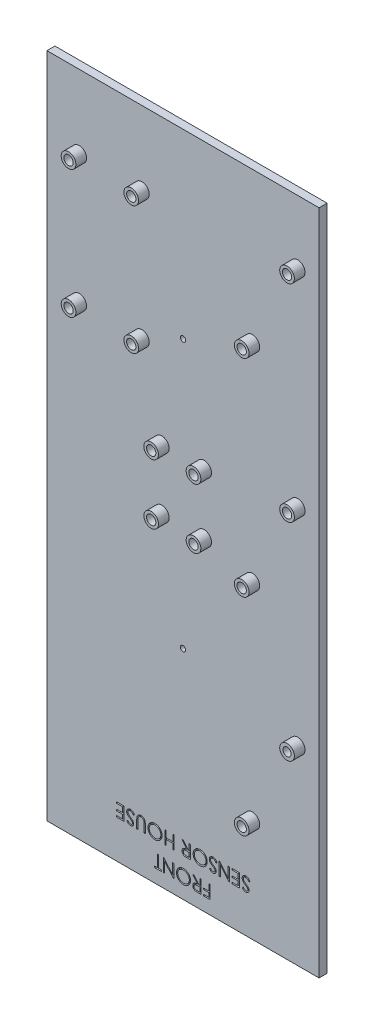
from build123d import *

# Parameters (mm, degrees)
BOSS_EXTRUDE1_DEPTH = 3
SKETCH2_R           = 1
CUT_EXTRUDE1_DEPTH  = 3
SKETCH5_R           = 2.75
BOSS_EXTRUDE2_DEPTH = 4
SKETCH6_R           = 1.75
SKETCH6_R_2         = 1.54123494
CUT_EXTRUDE2_DEPTH  = 4
CUT_EXTRUDE3_DEPTH  = 1


with BuildPart() as part:
    # Sketch1 → Boss-Extrude1 (new body)
    with BuildSketch(Plane(origin=(0, 0, 0), x_dir=(0, 1, 0), z_dir=(0, 0, 1))):
        Polygon((0, 110), (0, 8), (250, 8), (250, 85), (250, 110), (225, 110), (199.75, 110), (171.25, 110), align=None)
    extrude(amount=BOSS_EXTRUDE1_DEPTH)

    # Sketch2 → Cut-Extrude1 (cut)
    with BuildSketch(Plane.XY.offset(3)):
        with Locations((-59, 81.4)):
            Circle(SKETCH2_R)
        with Locations((-59, 181.94)):
            Circle(SKETCH2_R)
    extrude(amount=-CUT_EXTRUDE1_DEPTH, mode=Mode.SUBTRACT)

    # Sketch5 → Boss-Extrude2 (add)
    with BuildSketch(Plane.XY.offset(3)):
        with Locations((-66.934406815, 143.75)):
            Circle(SKETCH5_R)
        with Locations((-51.065593185, 143.75)):
            Circle(SKETCH5_R)
        with Locations((-66.934406815, 121.25)):
            Circle(SKETCH5_R)
        with Locations((-51.065593185, 121.25)):
            Circle(SKETCH5_R)
        with Locations((-16, 148.878093915)):
            Circle(SKETCH5_R)
        with Locations((-33, 116.121906085)):
            Circle(SKETCH5_R)
        with Locations((-16, 71.399280356)):
            Circle(SKETCH5_R)
        with Locations((-33, 38.643092525)):
            Circle(SKETCH5_R)
        with Locations((-16, 226.356907475)):
            Circle(SKETCH5_R)
        with Locations((-33, 193.600719644)):
            Circle(SKETCH5_R)
        with Locations((-97.892667427, 222.5)):
            Circle(SKETCH5_R)
        with Locations((-74.392667427, 222.5)):
            Circle(SKETCH5_R)
        with Locations((-74.392667427, 174.5)):
            Circle(SKETCH5_R)
        with Locations((-97.892667427, 174.5)):
            Circle(SKETCH5_R)
    extrude(amount=BOSS_EXTRUDE2_DEPTH)

    # Sketch6 → Cut-Extrude2 (cut)
    with BuildSketch(Plane.XY.offset(3)):
        with Locations((-66.934406815, 143.75)):
            Circle(SKETCH6_R)
        with Locations((-51.065593185, 143.75)):
            Circle(SKETCH6_R)
        with Locations((-66.934406815, 121.25)):
            Circle(SKETCH6_R)
        with Locations((-51.065593185, 121.25)):
            Circle(SKETCH6_R)
        with Locations((-33, 116.121906085)):
            Circle(SKETCH6_R)
        with Locations((-16, 148.878093915)):
            Circle(SKETCH6_R)
        with Locations((-16, 71.399280356)):
            Circle(SKETCH6_R_2)
        with Locations((-33, 38.643092525)):
            Circle(SKETCH6_R)
        with Locations((-16, 226.356907475)):
            Circle(SKETCH6_R)
        with Locations((-33, 193.600719644)):
            Circle(SKETCH6_R)
        with Locations((-97.892667427, 222.5)):
            Circle(SKETCH6_R)
        with Locations((-74.392667427, 222.5)):
            Circle(SKETCH6_R)
        with Locations((-74.392667427, 174.5)):
            Circle(SKETCH6_R)
        with Locations((-97.892667427, 174.5)):
            Circle(SKETCH6_R)
    extrude(amount=CUT_EXTRUDE2_DEPTH, mode=Mode.SUBTRACT)

    # Sketch7 → Cut-Extrude3 (cut)
    # profile 1 of 16: a face of its own
    with BuildSketch(Plane.XY.offset(3)):
        Polygon((-48.871794872, 5), (-51.307692308, 5), (-51.307692308, 5.512820513), (-49.320512821, 5.512820513), (-49.320512821, 7.051282051), (-51.307692308, 7.051282051), (-51.307692308, 7.564102564), (-49.320512821, 7.564102564), (-49.320512821, 10), (-48.871794872, 10), align=None)
    # profile 2 of 16: a face of its own
    with BuildSketch(Plane.XY.offset(3)):
        with BuildLine():
            Line((-52.205128205, 5), (-53.205729167, 5))
            add(Edge.make_bspline(
                [(-53.205729167, 5), (-53.272502207, 5.000222266), (-53.400713842, 5.00064904), (-53.584389943, 5.003028702), (-53.751285796, 5.00984921), (-53.901314138, 5.015718615), (-54.034472216, 5.026421388), (-54.151168346, 5.036650884), (-54.250865056, 5.050041828), (-54.311216273, 5.062478147), (-54.338541667, 5.068108974)],
                knots=[0, 0, 0, 0, 1.410062039, 2.707475311, 3.878576406, 4.937260626, 5.877586885, 6.699081471, 7.410979367, 8, 8, 8, 8], degree=3))
            add(Edge.make_bspline(
                [(-54.338541667, 5.068108974), (-54.375123174, 5.07714621), (-54.447505806, 5.095027892), (-54.551711251, 5.132841841), (-54.651050395, 5.176530595), (-54.745159456, 5.228236592), (-54.834013773, 5.287086712), (-54.917604395, 5.353317533), (-54.994810536, 5.427496518), (-55.068379071, 5.506550883), (-55.132618455, 5.593922556), (-55.190450942, 5.685177658), (-55.238999334, 5.782073076), (-55.2772015, 5.884120092), (-55.309227494, 5.990317675), (-55.330751953, 6.101715204), (-55.344157762, 6.217950245), (-55.345482256, 6.297037797), (-55.346153846, 6.337139423)],
                knots=[0, 0, 0, 0, 1.027276577, 2.032638556, 3.019345632, 3.985365262, 4.957888996, 5.923693931, 6.890056973, 7.876427719, 8.865527834, 9.843495157, 10.821038291, 11.815616373, 12.812734995, 13.843357168, 14.906466538, 16, 16, 16, 16], degree=3))
            add(Edge.make_bspline(
                [(-55.346153846, 6.337139423), (-55.344055332, 6.403761078), (-55.339960587, 6.533757181), (-55.301781107, 6.722414513), (-55.239246003, 6.898403164), (-55.153059627, 7.06147822), (-55.04335545, 7.20854682), (-54.911515976, 7.337285065), (-54.758214499, 7.446010379), (-54.614830849, 7.520605528), (-54.488113158, 7.568603243), (-54.383485058, 7.602544146), (-54.269266824, 7.628325542), (-54.147097089, 7.651757228), (-54.016032203, 7.669637487), (-53.876336097, 7.682335869), (-53.727659384, 7.690501025), (-53.625745439, 7.691693989), (-53.573317308, 7.692307692)],
                knots=[0, 0, 0, 0, 1.260402266, 2.459371274, 3.627181936, 4.786749125, 5.93865593, 7.087644312, 8.261344208, 9.485713728, 10.136162886, 10.825977872, 11.566646758, 12.35154167, 13.181268117, 14.0701832, 15.007234106, 16, 16, 16, 16], degree=3))
            Line((-53.573317308, 7.692307692), (-55.41025641, 10))
            Line((-55.41025641, 10), (-54.85536859, 10))
            Line((-54.85536859, 10), (-53.018429487, 7.692307692))
            Line((-53.018429487, 7.692307692), (-52.653846154, 7.692307692))
            Line((-52.653846154, 7.692307692), (-52.653846154, 10))
            Line((-52.653846154, 10), (-52.205128205, 10))
            Line((-52.205128205, 10), (-52.205128205, 5))
        make_face()
        with BuildLine():
            Line((-52.653846154, 5.512820513), (-52.653846154, 7.179487179))
            Line((-52.653846154, 7.179487179), (-53.569310897, 7.186498397))
            add(Edge.make_bspline(
                [(-53.569310897, 7.186498397), (-53.612053816, 7.186517318), (-53.694901765, 7.186553991), (-53.814759784, 7.180848449), (-53.926360192, 7.174358495), (-54.029274724, 7.164429189), (-54.123553982, 7.151640285), (-54.209135694, 7.135618136), (-54.286208984, 7.117030613), (-54.375812758, 7.087967587), (-54.477020368, 7.043907873), (-54.584742254, 6.975589456), (-54.678941959, 6.892968401), (-54.757258613, 6.797297653), (-54.820162638, 6.691657375), (-54.863855087, 6.578438363), (-54.892648156, 6.459424494), (-54.895821584, 6.377707186), (-54.897435897, 6.336137821)],
                knots=[0, 0, 0, 0, 1.146399208, 2.222048177, 3.218135709, 4.144938032, 4.994811973, 5.769438708, 6.479732432, 7.119818093, 8.294689872, 9.430121864, 10.527913442, 11.641375077, 12.733452768, 13.811150417, 14.886538365, 16, 16, 16, 16], degree=3))
            add(Edge.make_bspline(
                [(-54.897435897, 6.336137821), (-54.895739845, 6.295920566), (-54.892378888, 6.216224642), (-54.864313535, 6.099814452), (-54.818487258, 5.989123639), (-54.755762846, 5.885675382), (-54.677695589, 5.792467042), (-54.586764817, 5.712960194), (-54.485110332, 5.646908171), (-54.390870011, 5.603326886), (-54.306020533, 5.57768359), (-54.232689759, 5.559069149), (-54.149109846, 5.546032438), (-54.056264519, 5.534042147), (-53.953745914, 5.523888208), (-53.841491557, 5.517148523), (-53.71958171, 5.513120202), (-53.635086117, 5.512922734), (-53.591346154, 5.512820513)],
                knots=[0, 0, 0, 0, 1.100596872, 2.180981401, 3.259506136, 4.371595435, 5.481727359, 6.576991111, 7.667816242, 8.793363246, 9.406619729, 10.09427138, 10.864108636, 11.721733836, 12.6590937, 13.685439239, 14.801845161, 16, 16, 16, 16], degree=3))
            Line((-53.591346154, 5.512820513), (-52.653846154, 5.512820513))
        make_face(mode=Mode.SUBTRACT)
    # profile 3 of 16: a face of its own
    with BuildSketch(Plane.XY.offset(3)):
        with BuildLine():
            add(Edge.make_bspline(
                [(-58.775641026, 4.871794872), (-58.86823411, 4.874100387), (-59.050094567, 4.87862861), (-59.317125576, 4.914435144), (-59.572818523, 4.973370567), (-59.817326125, 5.056594322), (-60.049697435, 5.164503773), (-60.270667111, 5.295508269), (-60.47947562, 5.450895324), (-60.675582894, 5.626976321), (-60.853825443, 5.820526125), (-61.008925344, 6.028315475), (-61.140929826, 6.246162152), (-61.248782206, 6.475484849), (-61.333528878, 6.715259712), (-61.391975282, 6.966915129), (-61.429318057, 7.22877996), (-61.433683101, 7.407390024), (-61.435897436, 7.497996795)],
                knots=[0, 0, 0, 0, 1.065027606, 2.091802087, 3.093458616, 4.079833113, 5.057734272, 6.036020118, 7.030157768, 8.047461502, 9.064242947, 10.052216774, 11.02588392, 11.989864716, 12.962978571, 13.945936472, 14.957997893, 16, 16, 16, 16], degree=3))
            add(Edge.make_bspline(
                [(-61.435897436, 7.497996795), (-61.433682359, 7.587935615), (-61.429316187, 7.76521545), (-61.39194494, 8.025425942), (-61.333268236, 8.27553505), (-61.249830601, 8.514961054), (-61.141898777, 8.743821511), (-61.009686585, 8.961820608), (-60.854935147, 9.170215848), (-60.6774234, 9.364707839), (-60.483579121, 9.54296683), (-60.27707355, 9.700550458), (-60.058155874, 9.831826655), (-59.830242864, 9.941291335), (-59.591066279, 10.024196207), (-59.34231297, 10.084610491), (-59.082572485, 10.121576926), (-58.905637048, 10.125971483), (-58.815705128, 10.128205128)],
                knots=[0, 0, 0, 0, 1.043683505, 2.0572211, 3.045299494, 4.022276905, 4.994977706, 5.977452478, 6.97747046, 8.003698437, 9.029677512, 10.031249186, 11.013723958, 11.988083691, 12.9614021, 13.946617861, 14.956316495, 16, 16, 16, 16], degree=3))
            add(Edge.make_bspline(
                [(-58.815705128, 10.128205128), (-58.725098781, 10.125992015), (-58.546489552, 10.121629381), (-58.284296327, 10.084223115), (-58.032461663, 10.025751157), (-57.791760955, 9.942109112), (-57.562115214, 9.834418535), (-57.34354665, 9.70208281), (-57.13579262, 9.546143332), (-56.940967262, 9.368770986), (-56.762923221, 9.175298416), (-56.606323206, 8.96906399), (-56.474750424, 8.752029115), (-56.367014386, 8.525088452), (-56.281799283, 8.288828601), (-56.223644158, 8.041763401), (-56.18602283, 7.785277293), (-56.181687134, 7.610644733), (-56.179487179, 7.522035256)],
                knots=[0, 0, 0, 0, 1.053167129, 2.076072758, 3.073341244, 4.055601477, 5.033424535, 6.017524495, 7.021518915, 8.049444456, 9.077120685, 10.074910483, 11.055688766, 12.022980584, 12.991883888, 13.970269434, 14.970104079, 16, 16, 16, 16], degree=3))
            add(Edge.make_bspline(
                [(-56.179487179, 7.522035256), (-56.180250244, 7.462559743), (-56.181766747, 7.344359026), (-56.200050898, 7.168839311), (-56.226528994, 6.996123382), (-56.264674751, 6.826791826), (-56.313879542, 6.660816991), (-56.3745161, 6.498538306), (-56.444005619, 6.338619071), (-56.526742489, 6.184102832), (-56.617010891, 6.034747065), (-56.715439514, 5.892419341), (-56.822714647, 5.759662016), (-56.937303892, 5.634341893), (-57.060793419, 5.518597902), (-57.191324715, 5.409906557), (-57.32958078, 5.30939299), (-57.475780269, 5.219168264), (-57.626195769, 5.136295757), (-57.781918554, 5.067104034), (-57.939663028, 5.005947829), (-58.100818667, 4.957346782), (-58.265012692, 4.918669779), (-58.432450363, 4.892389733), (-58.602959221, 4.874064955), (-58.71783277, 4.872554822), (-58.775641026, 4.871794872)],
                knots=[0, 0, 0, 0, 1.037115869, 2.061148057, 3.07517727, 4.084041727, 5.086514338, 6.092668487, 7.104487461, 8.125783165, 9.147610153, 10.147694368, 11.141876323, 12.122903372, 13.107606018, 14.091946891, 15.084523921, 16.086505767, 17.087268121, 18.077809654, 19.05670789, 20.036870126, 21.011670792, 21.99694167, 22.991993299, 24, 24, 24, 24], degree=3))
        make_face()
        with BuildLine():
            add(Edge.make_bspline(
                [(-58.797676282, 5.384615385), (-58.75022609, 5.385191505), (-58.655779333, 5.386338238), (-58.515383433, 5.401537467), (-58.376783691, 5.423023873), (-58.240284608, 5.454309544), (-58.105764114, 5.494396377), (-57.973072895, 5.543897878), (-57.842092457, 5.601687527), (-57.714020548, 5.668768323), (-57.590902529, 5.743958931), (-57.471998628, 5.823234797), (-57.361849932, 5.91108917), (-57.258328882, 6.004264091), (-57.161686632, 6.104042449), (-57.071910271, 6.209689218), (-56.989088248, 6.321682686), (-56.914213313, 6.439556229), (-56.847580674, 6.562653271), (-56.787921623, 6.688620313), (-56.738466559, 6.81893784), (-56.699290777, 6.952792603), (-56.666039516, 7.089594741), (-56.645181864, 7.2300896), (-56.62983701, 7.373792844), (-56.628753277, 7.470910332), (-56.628205128, 7.520032051)],
                knots=[0, 0, 0, 0, 1.008431664, 2.007222653, 2.999229743, 3.989431819, 4.982149843, 5.98167215, 6.998687425, 8.024288174, 9.053028776, 10.065052016, 11.06063401, 12.045759335, 13.024701188, 14.011819507, 14.991481775, 15.984022113, 16.97831254, 17.965966747, 18.945551853, 19.938269878, 20.93007375, 21.936103907, 22.956087853, 24, 24, 24, 24], degree=3))
            add(Edge.make_bspline(
                [(-56.628205128, 7.520032051), (-56.630030526, 7.592262153), (-56.63362165, 7.734361108), (-56.664930155, 7.942624745), (-56.713539703, 8.142969779), (-56.784014364, 8.334202078), (-56.873918702, 8.517174398), (-56.983583742, 8.691174677), (-57.114013785, 8.856151586), (-57.262083718, 9.010877038), (-57.423994286, 9.152044866), (-57.595837078, 9.276132129), (-57.776252537, 9.38056743), (-57.964200796, 9.467872995), (-58.161286522, 9.533645375), (-58.366246081, 9.580541052), (-58.579084, 9.610935473), (-58.724120707, 9.613887494), (-58.797676282, 9.615384615)],
                knots=[0, 0, 0, 0, 1.032022337, 2.030307203, 3.003823408, 3.974715386, 4.937372378, 5.913284036, 6.909147208, 7.938749767, 8.970518239, 9.975863271, 10.963918693, 11.946286286, 12.933361397, 13.927862637, 14.949112547, 16, 16, 16, 16], degree=3))
            add(Edge.make_bspline(
                [(-58.797676282, 9.615384615), (-58.847118623, 9.614705873), (-58.945177635, 9.613359724), (-59.09102551, 9.599782126), (-59.234259447, 9.578052563), (-59.374614339, 9.546611363), (-59.512275788, 9.507783805), (-59.646822076, 9.459614732), (-59.778232297, 9.401899423), (-59.907063012, 9.337474419), (-60.030523754, 9.264815096), (-60.14721249, 9.184980308), (-60.257896586, 9.100107694), (-60.361228683, 9.00760754), (-60.45746747, 8.908670861), (-60.545639323, 8.802577116), (-60.62842273, 8.691422617), (-60.702772504, 8.573579035), (-60.770319213, 8.451456019), (-60.828225696, 8.325122271), (-60.877709178, 8.195377946), (-60.917590755, 8.062095005), (-60.948860099, 7.92558201), (-60.970401648, 7.785641219), (-60.985471169, 7.642556627), (-60.986606949, 7.545779665), (-60.987179487, 7.496995192)],
                knots=[0, 0, 0, 0, 1.047362266, 2.077233941, 3.100744636, 4.115120168, 5.122788643, 6.129711893, 7.140355774, 8.162227187, 9.180148637, 10.17298275, 11.156396779, 12.133377858, 13.108923632, 14.078087502, 15.054351192, 16.043448276, 17.028082865, 18.009331763, 18.985518559, 19.968016174, 20.954783108, 21.950335389, 22.966780876, 24, 24, 24, 24], degree=3))
            add(Edge.make_bspline(
                [(-60.987179487, 7.496995192), (-60.986606469, 7.448544472), (-60.985469781, 7.352433543), (-60.970409103, 7.21034666), (-60.948836402, 7.0714135), (-60.917746819, 6.936179497), (-60.877675172, 6.804610173), (-60.828264695, 6.676829113), (-60.770000002, 6.552360233), (-60.703131033, 6.43151135), (-60.627965857, 6.315547018), (-60.545830162, 6.204687987), (-60.455312198, 6.101006828), (-60.358974488, 6.00197901), (-60.254500888, 5.909585212), (-60.141873077, 5.824182737), (-60.023895671, 5.741922448), (-59.897899435, 5.669124663), (-59.768337007, 5.601546236), (-59.635255207, 5.54393944), (-59.500318216, 5.494176497), (-59.363345809, 5.454482189), (-59.224574596, 5.422993481), (-59.083966019, 5.401545253), (-58.941572288, 5.386336605), (-58.845793828, 5.385190945), (-58.797676282, 5.384615385)],
                knots=[0, 0, 0, 0, 1.02988216, 2.042960975, 3.035124439, 4.018561492, 4.99104521, 5.957523397, 6.929462691, 7.91146347, 8.892205782, 9.866320947, 10.842813644, 11.816825305, 12.802668543, 13.805243666, 14.821427616, 15.858893029, 16.897256944, 17.927432741, 18.940436917, 19.95373962, 20.957947499, 21.96413624, 22.977215056, 24, 24, 24, 24], degree=3))
        make_face(mode=Mode.SUBTRACT)
    # profile 4 of 16: a face of its own
    with BuildSketch(Plane.XY.offset(3)):
        Polygon((-62.461538462, 10), (-62.461538462, 5), (-62.555689103, 5), (-65.858974359, 8.935296474), (-65.858974359, 5), (-66.307692308, 5), (-66.307692308, 10), (-66.205528846, 10), (-62.91025641, 6.073717949), (-62.91025641, 10), align=None)
    # profile 5 of 16: a face of its own
    with BuildSketch(Plane.XY.offset(3)):
        Polygon((-67.012820513, 5.512820513), (-67.012820513, 5), (-69.641025641, 5), (-69.641025641, 5.512820513), (-68.551282051, 5.512820513), (-68.551282051, 10), (-68.102564103, 10), (-68.102564103, 5.512820513), align=None)
    # profile 6 of 16: a face of its own
    with BuildSketch(Plane.XY.offset(3)):
        with BuildLine():
            Line((-33.903846154, 18.3046875), (-34.326522436, 18.051282051))
            add(Edge.make_bspline(
                [(-34.326522436, 18.051282051), (-34.365834203, 18.117088315), (-34.441154033, 18.243170578), (-34.566798832, 18.413539207), (-34.696988705, 18.558342288), (-34.832687753, 18.676737442), (-34.973067679, 18.769950137), (-35.119044898, 18.835953326), (-35.270127485, 18.877119005), (-35.37294723, 18.882119128), (-35.424278846, 18.884615385)],
                knots=[0, 0, 0, 0, 1.272034388, 2.437168799, 3.508375237, 4.49857839, 5.41946034, 6.295179144, 7.148887113, 8, 8, 8, 8], degree=3))
            add(Edge.make_bspline(
                [(-35.424278846, 18.884615385), (-35.468108348, 18.883365378), (-35.555000438, 18.880887238), (-35.683170228, 18.858037499), (-35.807026207, 18.820655496), (-35.925335669, 18.769979711), (-36.034969663, 18.707689686), (-36.132634812, 18.634232701), (-36.215155084, 18.549374749), (-36.283376968, 18.456175456), (-36.336782187, 18.356580274), (-36.374781273, 18.253041963), (-36.399191062, 18.146220299), (-36.402285874, 18.073780744), (-36.403846154, 18.037259615)],
                knots=[0, 0, 0, 0, 1.095645842, 2.172120455, 3.244862764, 4.326153987, 5.384857088, 6.392105572, 7.372507978, 8.334705661, 9.272564127, 10.189475455, 11.087205874, 12, 12, 12, 12], degree=3))
            add(Edge.make_bspline(
                [(-36.403846154, 18.037259615), (-36.401785231, 17.995615935), (-36.397611639, 17.911282942), (-36.36082949, 17.786646632), (-36.304664688, 17.662771972), (-36.251876086, 17.586133083), (-36.224559295, 17.546474359)],
                knots=[0, 0, 0, 0, 0.938992559, 1.901562324, 2.914110574, 4, 4, 4, 4], degree=3))
            add(Edge.make_bspline(
                [(-36.224559295, 17.546474359), (-36.20223937, 17.517773867), (-36.155243933, 17.457343908), (-36.073262122, 17.368971463), (-35.980043637, 17.275401353), (-35.873175018, 17.178501223), (-35.754214639, 17.076288904), (-35.621813824, 16.970660046), (-35.477518559, 16.860039239), (-35.375742907, 16.786977377), (-35.323116987, 16.749198718)],
                knots=[0, 0, 0, 0, 0.722283655, 1.520795216, 2.39349503, 3.346893347, 4.386874146, 5.510198126, 6.712579003, 8, 8, 8, 8], degree=3))
            add(Edge.make_bspline(
                [(-35.323116987, 16.749198718), (-35.270518295, 16.711720731), (-35.169953602, 16.640065673), (-35.029207768, 16.533856142), (-34.903518754, 16.436131638), (-34.792246111, 16.348253427), (-34.698268606, 16.266388709), (-34.618150681, 16.194924973), (-34.554848192, 16.130046138), (-34.519621849, 16.087991895), (-34.50380609, 16.069110577)],
                knots=[0, 0, 0, 0, 1.452255772, 2.776602448, 3.96446981, 5.032613149, 5.964194703, 6.766668629, 7.446264616, 8, 8, 8, 8], degree=3))
            add(Edge.make_bspline(
                [(-34.50380609, 16.069110577), (-34.481706159, 16.039679063), (-34.438243678, 15.981798042), (-34.380810877, 15.891354778), (-34.332377639, 15.798947512), (-34.293397939, 15.704241341), (-34.261876531, 15.607948037), (-34.239961067, 15.509344669), (-34.226452838, 15.409100614), (-34.225057476, 15.341655091), (-34.224358974, 15.307892628)],
                knots=[0, 0, 0, 0, 1.068019517, 2.100403715, 3.106014851, 4.09224787, 5.069873182, 6.043214339, 7.020455327, 8, 8, 8, 8], degree=3))
            add(Edge.make_bspline(
                [(-34.224358974, 15.307892628), (-34.226215342, 15.254988418), (-34.229888399, 15.150310787), (-34.261208347, 14.997475361), (-34.310059033, 14.851106016), (-34.380734777, 14.714460402), (-34.468032545, 14.587732225), (-34.57165516, 14.473169534), (-34.693543183, 14.374715718), (-34.82923568, 14.291022105), (-34.976026994, 14.224253268), (-35.130296057, 14.175601311), (-35.291349665, 14.147088294), (-35.400796294, 14.143066382), (-35.456330128, 14.141025641)],
                knots=[0, 0, 0, 0, 1.005367131, 1.989245246, 2.955191616, 3.932180104, 4.904534562, 5.875498653, 6.859376768, 7.874484044, 8.900379497, 9.918679785, 10.943926428, 12, 12, 12, 12], degree=3))
            add(Edge.make_bspline(
                [(-35.456330128, 14.141025641), (-35.51526848, 14.142992356), (-35.63215028, 14.146892587), (-35.804128171, 14.182889736), (-35.970696515, 14.238819907), (-36.10418797, 14.305431664), (-36.208703133, 14.371243973), (-36.288323367, 14.431340485), (-36.369446884, 14.50037679), (-36.451199611, 14.579815397), (-36.534389284, 14.668065356), (-36.618632515, 14.765874333), (-36.704717734, 14.872360727), (-36.760080137, 14.948398981), (-36.788461538, 14.987379808)],
                knots=[0, 0, 0, 0, 1.286534051, 2.551350862, 3.822568981, 5.117864672, 5.799956111, 6.519305446, 7.295594771, 8.126302591, 9.008831062, 9.944975596, 10.946496709, 12, 12, 12, 12], degree=3))
            Line((-36.788461538, 14.987379808), (-36.3828125, 15.294871795))
            add(Edge.make_bspline(
                [(-36.3828125, 15.294871795), (-36.358320097, 15.263314696), (-36.311153455, 15.202543101), (-36.239516144, 15.117465526), (-36.172098584, 15.03964534), (-36.105167637, 14.972230386), (-36.043882555, 14.91017162), (-35.983344707, 14.857983992), (-35.925892757, 14.814010706), (-35.853640534, 14.76702149), (-35.761880006, 14.721559075), (-35.64776713, 14.682472236), (-35.528437229, 14.658451054), (-35.447426794, 14.655397994), (-35.40625, 14.653846154)],
                knots=[0, 0, 0, 0, 1.181426797, 2.275151783, 3.28963443, 4.225459815, 5.084396437, 5.868484344, 6.587427557, 7.222918358, 8.415355282, 9.605213164, 10.782753814, 12, 12, 12, 12], degree=3))
            add(Edge.make_bspline(
                [(-35.40625, 14.653846154), (-35.354585636, 14.65554881), (-35.254955777, 14.658832221), (-35.113840075, 14.695635612), (-34.98609515, 14.751592688), (-34.876597643, 14.832282209), (-34.786187249, 14.928479659), (-34.719976254, 15.038186077), (-34.680389864, 15.159352546), (-34.675544559, 15.243833952), (-34.673076923, 15.286858974)],
                knots=[0, 0, 0, 0, 1.144248881, 2.206576175, 3.214949548, 4.222996039, 5.203671638, 6.127710127, 7.046472867, 8, 8, 8, 8], degree=3))
            add(Edge.make_bspline(
                [(-34.673076923, 15.286858974), (-34.673697155, 15.313633619), (-34.674946258, 15.367555889), (-34.689838601, 15.447058598), (-34.712062301, 15.525625377), (-34.743563782, 15.603708884), (-34.786374667, 15.683533652), (-34.844519365, 15.764644694), (-34.917279755, 15.849072008), (-34.973121439, 15.903929516), (-35.002604167, 15.932892628)],
                knots=[0, 0, 0, 0, 0.858500039, 1.728959331, 2.587258638, 3.476905708, 4.426389682, 5.487945037, 6.673710648, 8, 8, 8, 8], degree=3))
            add(Edge.make_bspline(
                [(-35.002604167, 15.932892628), (-35.013548984, 15.942659808), (-35.039551366, 15.965864391), (-35.087088403, 16.003853364), (-35.149863829, 16.050714467), (-35.226238402, 16.108696348), (-35.317620347, 16.175955579), (-35.424019713, 16.251632168), (-35.544250474, 16.338182824), (-35.629567497, 16.398693596), (-35.674679487, 16.430689103)],
                knots=[0, 0, 0, 0, 0.420754252, 0.999615792, 1.744751191, 2.668019286, 3.750313428, 4.999500688, 6.413464383, 8, 8, 8, 8], degree=3))
            add(Edge.make_bspline(
                [(-35.674679487, 16.430689103), (-35.728945039, 16.470176787), (-35.83402276, 16.546639215), (-35.983534106, 16.661518381), (-36.119094916, 16.773873628), (-36.241191163, 16.882980155), (-36.35099548, 16.988034742), (-36.447400975, 17.090219844), (-36.530845064, 17.188865344), (-36.621905424, 17.314474993), (-36.713849394, 17.470172751), (-36.792683791, 17.661017858), (-36.842836885, 17.85241063), (-36.849350388, 17.980883349), (-36.852564103, 18.044270833)],
                knots=[0, 0, 0, 0, 1.163604038, 2.253157948, 3.268574773, 4.215621239, 5.091738613, 5.902582348, 6.650434646, 7.330118262, 8.591011492, 9.77460283, 10.902005569, 12, 12, 12, 12], degree=3))
            add(Edge.make_bspline(
                [(-36.852564103, 18.044270833), (-36.851623855, 18.089096241), (-36.849761619, 18.177876576), (-36.828410388, 18.308253019), (-36.79701661, 18.434823744), (-36.75022796, 18.556013637), (-36.691740789, 18.673173368), (-36.620533125, 18.786097513), (-36.534237545, 18.892930607), (-36.438373509, 18.995747379), (-36.331892819, 19.088734983), (-36.219214509, 19.171557582), (-36.100971015, 19.242472139), (-35.975812018, 19.29818419), (-35.845799228, 19.342749067), (-35.710322353, 19.374691998), (-35.569090282, 19.394363485), (-35.473088206, 19.396400327), (-35.424278846, 19.397435897)],
                knots=[0, 0, 0, 0, 0.98378539, 1.948466333, 2.894822735, 3.844243623, 4.795447569, 5.768042124, 6.770299647, 7.807997672, 8.852593179, 9.870666288, 10.876941106, 11.874841786, 12.874492863, 13.892063892, 14.928283473, 16, 16, 16, 16], degree=3))
            add(Edge.make_bspline(
                [(-35.424278846, 19.397435897), (-35.386515737, 19.39669727), (-35.311465107, 19.395229319), (-35.200754109, 19.382559132), (-35.092076108, 19.363978142), (-34.986795654, 19.335648889), (-34.883601937, 19.300468368), (-34.783414337, 19.257395234), (-34.685991172, 19.206117644), (-34.591212097, 19.146556283), (-34.498209616, 19.077896019), (-34.407359074, 18.998620508), (-34.318205677, 18.909109212), (-34.230379092, 18.809486694), (-34.145948186, 18.698106265), (-34.062789773, 18.576734288), (-33.981336863, 18.444978654), (-33.930158845, 18.352324666), (-33.903846154, 18.3046875)],
                knots=[0, 0, 0, 0, 0.915366252, 1.81920441, 2.69897508, 3.586533125, 4.459536084, 5.340758185, 6.227946952, 7.126403341, 8.052553006, 9.028121456, 10.047063623, 11.114014537, 12.24582441, 13.433687931, 14.680555077, 16, 16, 16, 16], degree=3))
        make_face()
    # profile 7 of 16: a face of its own
    with BuildSketch(Plane.XY.offset(3)):
        Polygon((-37.878205128, 14.269230769), (-40.698717949, 14.269230769), (-40.698717949, 14.782051282), (-38.326923077, 14.782051282), (-38.326923077, 16.320512821), (-40.698717949, 16.320512821), (-40.698717949, 16.833333333), (-38.326923077, 16.833333333), (-38.326923077, 18.756410256), (-40.698717949, 18.756410256), (-40.698717949, 19.269230769), (-37.878205128, 19.269230769), align=None)
    # profile 8 of 16: a face of its own
    with BuildSketch(Plane.XY.offset(3)):
        Polygon((-41.596153846, 19.269230769), (-41.596153846, 14.269230769), (-41.690304487, 14.269230769), (-44.993589744, 18.204527244), (-44.993589744, 14.269230769), (-45.442307692, 14.269230769), (-45.442307692, 19.269230769), (-45.340144231, 19.269230769), (-42.044871795, 15.342948718), (-42.044871795, 19.269230769), align=None)
    # profile 9 of 16: a face of its own
    with BuildSketch(Plane.XY.offset(3)):
        with BuildLine():
            Line((-46.211538462, 18.3046875), (-46.634214744, 18.051282051))
            add(Edge.make_bspline(
                [(-46.634214744, 18.051282051), (-46.673526511, 18.117088315), (-46.748846341, 18.243170578), (-46.874491139, 18.413539207), (-47.004681012, 18.558342288), (-47.14038006, 18.676737442), (-47.280759986, 18.769950137), (-47.426737206, 18.835953326), (-47.577819793, 18.877119005), (-47.680639538, 18.882119128), (-47.731971154, 18.884615385)],
                knots=[0, 0, 0, 0, 1.272034388, 2.437168799, 3.508375237, 4.49857839, 5.41946034, 6.295179144, 7.148887113, 8, 8, 8, 8], degree=3))
            add(Edge.make_bspline(
                [(-47.731971154, 18.884615385), (-47.775800656, 18.883365378), (-47.862692746, 18.880887238), (-47.990862535, 18.858037499), (-48.114718515, 18.820655496), (-48.233027976, 18.769979711), (-48.342661971, 18.707689686), (-48.44032712, 18.634232701), (-48.522847392, 18.549374749), (-48.591069275, 18.456175456), (-48.644474495, 18.356580274), (-48.682473581, 18.253041963), (-48.70688337, 18.146220299), (-48.709978181, 18.073780744), (-48.711538462, 18.037259615)],
                knots=[0, 0, 0, 0, 1.095645842, 2.172120455, 3.244862764, 4.326153987, 5.384857088, 6.392105572, 7.372507978, 8.334705661, 9.272564127, 10.189475455, 11.087205874, 12, 12, 12, 12], degree=3))
            add(Edge.make_bspline(
                [(-48.711538462, 18.037259615), (-48.709477539, 17.995615935), (-48.705303947, 17.911282942), (-48.668521798, 17.786646632), (-48.612356996, 17.662771972), (-48.559568394, 17.586133083), (-48.532251603, 17.546474359)],
                knots=[0, 0, 0, 0, 0.938992559, 1.901562324, 2.914110574, 4, 4, 4, 4], degree=3))
            add(Edge.make_bspline(
                [(-48.532251603, 17.546474359), (-48.509931677, 17.517773867), (-48.462936241, 17.457343908), (-48.380954429, 17.368971463), (-48.287735944, 17.275401353), (-48.180867326, 17.178501223), (-48.061906947, 17.076288904), (-47.929506132, 16.970660046), (-47.785210867, 16.860039239), (-47.683435214, 16.786977377), (-47.630809295, 16.749198718)],
                knots=[0, 0, 0, 0, 0.722283655, 1.520795216, 2.39349503, 3.346893347, 4.386874146, 5.510198126, 6.712579003, 8, 8, 8, 8], degree=3))
            add(Edge.make_bspline(
                [(-47.630809295, 16.749198718), (-47.578210603, 16.711720731), (-47.47764591, 16.640065673), (-47.336900075, 16.533856142), (-47.211211061, 16.436131638), (-47.099938419, 16.348253427), (-47.005960913, 16.266388709), (-46.925842989, 16.194924973), (-46.862540499, 16.130046138), (-46.827314157, 16.087991895), (-46.811498397, 16.069110577)],
                knots=[0, 0, 0, 0, 1.452255772, 2.776602448, 3.96446981, 5.032613149, 5.964194703, 6.766668629, 7.446264616, 8, 8, 8, 8], degree=3))
            add(Edge.make_bspline(
                [(-46.811498397, 16.069110577), (-46.789398466, 16.039679063), (-46.745935985, 15.981798042), (-46.688503185, 15.891354778), (-46.640069947, 15.798947512), (-46.601090246, 15.704241341), (-46.569568839, 15.607948037), (-46.547653375, 15.509344669), (-46.534145146, 15.409100614), (-46.532749784, 15.341655091), (-46.532051282, 15.307892628)],
                knots=[0, 0, 0, 0, 1.068019517, 2.100403715, 3.106014851, 4.09224787, 5.069873182, 6.043214339, 7.020455327, 8, 8, 8, 8], degree=3))
            add(Edge.make_bspline(
                [(-46.532051282, 15.307892628), (-46.53390765, 15.254988418), (-46.537580707, 15.150310787), (-46.568900655, 14.997475361), (-46.61775134, 14.851106016), (-46.688427085, 14.714460402), (-46.775724852, 14.587732225), (-46.879347468, 14.473169534), (-47.001235491, 14.374715718), (-47.136927987, 14.291022105), (-47.283719302, 14.224253268), (-47.437988365, 14.175601311), (-47.599041973, 14.147088294), (-47.708488602, 14.143066382), (-47.764022436, 14.141025641)],
                knots=[0, 0, 0, 0, 1.005367131, 1.989245246, 2.955191616, 3.932180104, 4.904534562, 5.875498653, 6.859376768, 7.874484044, 8.900379497, 9.918679785, 10.943926428, 12, 12, 12, 12], degree=3))
            add(Edge.make_bspline(
                [(-47.764022436, 14.141025641), (-47.822960788, 14.142992356), (-47.939842588, 14.146892587), (-48.111820479, 14.182889736), (-48.278388823, 14.238819907), (-48.411880278, 14.305431664), (-48.516395441, 14.371243973), (-48.596015674, 14.431340485), (-48.677139192, 14.50037679), (-48.758891918, 14.579815397), (-48.842081592, 14.668065356), (-48.926324823, 14.765874333), (-49.012410042, 14.872360727), (-49.067772444, 14.948398981), (-49.096153846, 14.987379808)],
                knots=[0, 0, 0, 0, 1.286534051, 2.551350862, 3.822568981, 5.117864672, 5.799956111, 6.519305446, 7.295594771, 8.126302591, 9.008831062, 9.944975596, 10.946496709, 12, 12, 12, 12], degree=3))
            Line((-49.096153846, 14.987379808), (-48.690504808, 15.294871795))
            add(Edge.make_bspline(
                [(-48.690504808, 15.294871795), (-48.666012404, 15.263314696), (-48.618845762, 15.202543101), (-48.547208451, 15.117465526), (-48.479790892, 15.03964534), (-48.412859945, 14.972230386), (-48.351574863, 14.91017162), (-48.291037015, 14.857983992), (-48.233585065, 14.814010706), (-48.161332842, 14.76702149), (-48.069572314, 14.721559075), (-47.955459438, 14.682472236), (-47.836129537, 14.658451054), (-47.755119101, 14.655397994), (-47.713942308, 14.653846154)],
                knots=[0, 0, 0, 0, 1.181426797, 2.275151783, 3.28963443, 4.225459815, 5.084396437, 5.868484344, 6.587427557, 7.222918358, 8.415355282, 9.605213164, 10.782753814, 12, 12, 12, 12], degree=3))
            add(Edge.make_bspline(
                [(-47.713942308, 14.653846154), (-47.662277944, 14.65554881), (-47.562648084, 14.658832221), (-47.421532383, 14.695635612), (-47.293787458, 14.751592688), (-47.184289951, 14.832282209), (-47.093879557, 14.928479659), (-47.027668562, 15.038186077), (-46.988082172, 15.159352546), (-46.983236867, 15.243833952), (-46.980769231, 15.286858974)],
                knots=[0, 0, 0, 0, 1.144248881, 2.206576175, 3.214949548, 4.222996039, 5.203671638, 6.127710127, 7.046472867, 8, 8, 8, 8], degree=3))
            add(Edge.make_bspline(
                [(-46.980769231, 15.286858974), (-46.981389462, 15.313633619), (-46.982638565, 15.367555889), (-46.997530909, 15.447058598), (-47.019754609, 15.525625377), (-47.05125609, 15.603708884), (-47.094066975, 15.683533652), (-47.152211672, 15.764644694), (-47.224972063, 15.849072008), (-47.280813747, 15.903929516), (-47.310296474, 15.932892628)],
                knots=[0, 0, 0, 0, 0.858500039, 1.728959331, 2.587258638, 3.476905708, 4.426389682, 5.487945037, 6.673710648, 8, 8, 8, 8], degree=3))
            add(Edge.make_bspline(
                [(-47.310296474, 15.932892628), (-47.321241292, 15.942659808), (-47.347243674, 15.965864391), (-47.39478071, 16.003853364), (-47.457556137, 16.050714467), (-47.53393071, 16.108696348), (-47.625312655, 16.175955579), (-47.731712021, 16.251632168), (-47.851942782, 16.338182824), (-47.937259805, 16.398693596), (-47.982371795, 16.430689103)],
                knots=[0, 0, 0, 0, 0.420754252, 0.999615792, 1.744751191, 2.668019286, 3.750313428, 4.999500688, 6.413464383, 8, 8, 8, 8], degree=3))
            add(Edge.make_bspline(
                [(-47.982371795, 16.430689103), (-48.036637347, 16.470176787), (-48.141715068, 16.546639215), (-48.291226414, 16.661518381), (-48.426787224, 16.773873628), (-48.548883471, 16.882980155), (-48.658687788, 16.988034742), (-48.755093283, 17.090219844), (-48.838537371, 17.188865344), (-48.929597732, 17.314474993), (-49.021541702, 17.470172751), (-49.100376099, 17.661017858), (-49.150529193, 17.85241063), (-49.157042696, 17.980883349), (-49.16025641, 18.044270833)],
                knots=[0, 0, 0, 0, 1.163604038, 2.253157948, 3.268574773, 4.215621239, 5.091738613, 5.902582348, 6.650434646, 7.330118262, 8.591011492, 9.77460283, 10.902005569, 12, 12, 12, 12], degree=3))
            add(Edge.make_bspline(
                [(-49.16025641, 18.044270833), (-49.159316163, 18.089096241), (-49.157453927, 18.177876576), (-49.136102696, 18.308253019), (-49.104708917, 18.434823744), (-49.057920267, 18.556013637), (-48.999433096, 18.673173368), (-48.928225433, 18.786097513), (-48.841929853, 18.892930607), (-48.746065816, 18.995747379), (-48.639585127, 19.088734983), (-48.526906816, 19.171557582), (-48.408663322, 19.242472139), (-48.283504326, 19.29818419), (-48.153491535, 19.342749067), (-48.018014661, 19.374691998), (-47.87678259, 19.394363485), (-47.780780514, 19.396400327), (-47.731971154, 19.397435897)],
                knots=[0, 0, 0, 0, 0.98378539, 1.948466333, 2.894822735, 3.844243623, 4.795447569, 5.768042124, 6.770299647, 7.807997672, 8.852593179, 9.870666288, 10.876941106, 11.874841786, 12.874492863, 13.892063892, 14.928283473, 16, 16, 16, 16], degree=3))
            add(Edge.make_bspline(
                [(-47.731971154, 19.397435897), (-47.694208045, 19.39669727), (-47.619157415, 19.395229319), (-47.508446417, 19.382559132), (-47.399768416, 19.363978142), (-47.294487962, 19.335648889), (-47.191294245, 19.300468368), (-47.091106644, 19.257395234), (-46.993683479, 19.206117644), (-46.898904405, 19.146556283), (-46.805901923, 19.077896019), (-46.715051382, 18.998620508), (-46.625897985, 18.909109212), (-46.5380714, 18.809486694), (-46.453640494, 18.698106265), (-46.370482081, 18.576734288), (-46.28902917, 18.444978654), (-46.237851152, 18.352324666), (-46.211538462, 18.3046875)],
                knots=[0, 0, 0, 0, 0.915366252, 1.81920441, 2.69897508, 3.586533125, 4.459536084, 5.340758185, 6.227946952, 7.126403341, 8.052553006, 9.028121456, 10.047063623, 11.114014537, 12.24582441, 13.433687931, 14.680555077, 16, 16, 16, 16], degree=3))
        make_face()
    # profile 10 of 16: a face of its own
    with BuildSketch(Plane.XY.offset(3)):
        with BuildLine():
            add(Edge.make_bspline(
                [(-52.525641026, 14.141025641), (-52.61823411, 14.143331156), (-52.800094567, 14.147859379), (-53.067125576, 14.183665913), (-53.322818523, 14.242601336), (-53.567326125, 14.325825091), (-53.799697435, 14.433734543), (-54.020667111, 14.564739038), (-54.22947562, 14.720126094), (-54.425582894, 14.89620709), (-54.603825443, 15.089756895), (-54.758925344, 15.297546244), (-54.890929826, 15.515392921), (-54.998782206, 15.744715618), (-55.083528878, 15.984490481), (-55.141975282, 16.236145899), (-55.179318057, 16.498010729), (-55.183683101, 16.676620793), (-55.185897436, 16.767227564)],
                knots=[0, 0, 0, 0, 1.065027606, 2.091802087, 3.093458616, 4.079833113, 5.057734272, 6.036020118, 7.030157768, 8.047461502, 9.064242947, 10.052216774, 11.02588392, 11.989864716, 12.962978571, 13.945936472, 14.957997893, 16, 16, 16, 16], degree=3))
            add(Edge.make_bspline(
                [(-55.185897436, 16.767227564), (-55.183682359, 16.857166385), (-55.179316187, 17.034446219), (-55.14194494, 17.294656712), (-55.083268236, 17.54476582), (-54.999830601, 17.784191824), (-54.891898777, 18.01305228), (-54.759686585, 18.231051378), (-54.604935147, 18.439446617), (-54.4274234, 18.633938609), (-54.233579121, 18.812197599), (-54.02707355, 18.969781227), (-53.808155874, 19.101057424), (-53.580242864, 19.210522104), (-53.341066279, 19.293426976), (-53.09231297, 19.353841261), (-52.832572485, 19.390807695), (-52.655637048, 19.395202252), (-52.565705128, 19.397435897)],
                knots=[0, 0, 0, 0, 1.043683505, 2.0572211, 3.045299494, 4.022276905, 4.994977706, 5.977452478, 6.97747046, 8.003698437, 9.029677512, 10.031249186, 11.013723958, 11.988083691, 12.9614021, 13.946617861, 14.956316495, 16, 16, 16, 16], degree=3))
            add(Edge.make_bspline(
                [(-52.565705128, 19.397435897), (-52.475098781, 19.395222785), (-52.296489552, 19.39086015), (-52.034296327, 19.353453884), (-51.782461663, 19.294981926), (-51.541760955, 19.211339881), (-51.312115214, 19.103649305), (-51.09354665, 18.971313579), (-50.88579262, 18.815374102), (-50.690967262, 18.638001755), (-50.512923221, 18.444529185), (-50.356323206, 18.238294759), (-50.224750424, 18.021259885), (-50.117014386, 17.794319221), (-50.031799283, 17.558059371), (-49.973644158, 17.310994171), (-49.93602283, 17.054508063), (-49.931687134, 16.879875502), (-49.929487179, 16.791266026)],
                knots=[0, 0, 0, 0, 1.053167129, 2.076072758, 3.073341244, 4.055601477, 5.033424535, 6.017524495, 7.021518915, 8.049444456, 9.077120685, 10.074910483, 11.055688766, 12.022980584, 12.991883888, 13.970269434, 14.970104079, 16, 16, 16, 16], degree=3))
            add(Edge.make_bspline(
                [(-49.929487179, 16.791266026), (-49.930250244, 16.731790512), (-49.931766747, 16.613589796), (-49.950050898, 16.438070081), (-49.976528994, 16.265354151), (-50.014674751, 16.096022595), (-50.063879542, 15.93004776), (-50.1245161, 15.767769075), (-50.194005619, 15.60784984), (-50.276742489, 15.453333601), (-50.367010891, 15.303977835), (-50.465439514, 15.16165011), (-50.572714647, 15.028892785), (-50.687303892, 14.903572662), (-50.810793419, 14.787828671), (-50.941324715, 14.679137326), (-51.07958078, 14.578623759), (-51.225780269, 14.488399033), (-51.376195769, 14.405526526), (-51.531918554, 14.336334803), (-51.689663028, 14.275178598), (-51.850818667, 14.226577551), (-52.015012692, 14.187900548), (-52.182450363, 14.161620502), (-52.352959221, 14.143295724), (-52.46783277, 14.141785591), (-52.525641026, 14.141025641)],
                knots=[0, 0, 0, 0, 1.037115869, 2.061148057, 3.07517727, 4.084041727, 5.086514338, 6.092668487, 7.104487461, 8.125783165, 9.147610153, 10.147694368, 11.141876323, 12.122903372, 13.107606018, 14.091946891, 15.084523921, 16.086505767, 17.087268121, 18.077809654, 19.05670789, 20.036870126, 21.011670792, 21.99694167, 22.991993299, 24, 24, 24, 24], degree=3))
        make_face()
        with BuildLine():
            add(Edge.make_bspline(
                [(-52.547676282, 14.653846154), (-52.50022609, 14.654422274), (-52.405779333, 14.655569007), (-52.265383433, 14.670768236), (-52.126783691, 14.692254642), (-51.990284608, 14.723540313), (-51.855764114, 14.763627146), (-51.723072895, 14.813128647), (-51.592092457, 14.870918296), (-51.464020548, 14.937999092), (-51.340902529, 15.0131897), (-51.221998628, 15.092465567), (-51.111849932, 15.180319939), (-51.008328882, 15.27349486), (-50.911686632, 15.373273218), (-50.821910271, 15.478919987), (-50.739088248, 15.590913455), (-50.664213313, 15.708786999), (-50.597580674, 15.83188404), (-50.537921623, 15.957851082), (-50.488466559, 16.088168609), (-50.449290777, 16.222023372), (-50.416039516, 16.35882551), (-50.395181864, 16.499320369), (-50.37983701, 16.643023613), (-50.378753277, 16.740141101), (-50.378205128, 16.789262821)],
                knots=[0, 0, 0, 0, 1.008431664, 2.007222653, 2.999229743, 3.989431819, 4.982149843, 5.98167215, 6.998687425, 8.024288174, 9.053028776, 10.065052016, 11.06063401, 12.045759335, 13.024701188, 14.011819507, 14.991481775, 15.984022113, 16.97831254, 17.965966747, 18.945551853, 19.938269878, 20.93007375, 21.936103907, 22.956087853, 24, 24, 24, 24], degree=3))
            add(Edge.make_bspline(
                [(-50.378205128, 16.789262821), (-50.380030526, 16.861492922), (-50.38362165, 17.003591878), (-50.414930155, 17.211855514), (-50.463539703, 17.412200549), (-50.534014364, 17.603432848), (-50.623918702, 17.786405167), (-50.733583742, 17.960405446), (-50.864013785, 18.125382355), (-51.012083718, 18.280107807), (-51.173994286, 18.421275636), (-51.345837078, 18.545362898), (-51.526252537, 18.649798199), (-51.714200796, 18.737103764), (-51.911286522, 18.802876144), (-52.116246081, 18.849771821), (-52.329084, 18.880166242), (-52.474120707, 18.883118263), (-52.547676282, 18.884615385)],
                knots=[0, 0, 0, 0, 1.032022337, 2.030307203, 3.003823408, 3.974715386, 4.937372378, 5.913284036, 6.909147208, 7.938749767, 8.970518239, 9.975863271, 10.963918693, 11.946286286, 12.933361397, 13.927862637, 14.949112547, 16, 16, 16, 16], degree=3))
            add(Edge.make_bspline(
                [(-52.547676282, 18.884615385), (-52.597118623, 18.883936643), (-52.695177635, 18.882590494), (-52.84102551, 18.869012895), (-52.984259447, 18.847283332), (-53.124614339, 18.815842132), (-53.262275788, 18.777014575), (-53.396822076, 18.728845501), (-53.528232297, 18.671130192), (-53.657063012, 18.606705188), (-53.780523754, 18.534045865), (-53.89721249, 18.454211078), (-54.007896586, 18.369338463), (-54.111228683, 18.276838309), (-54.20746747, 18.177901631), (-54.295639323, 18.071807885), (-54.37842273, 17.960653387), (-54.452772504, 17.842809804), (-54.520319213, 17.720686788), (-54.578225696, 17.59435304), (-54.627709178, 17.464608715), (-54.667590755, 17.331325774), (-54.698860099, 17.194812779), (-54.720401648, 17.054871988), (-54.735471169, 16.911787397), (-54.736606949, 16.815010435), (-54.737179487, 16.766225962)],
                knots=[0, 0, 0, 0, 1.047362266, 2.077233941, 3.100744636, 4.115120168, 5.122788643, 6.129711893, 7.140355774, 8.162227187, 9.180148637, 10.17298275, 11.156396779, 12.133377858, 13.108923632, 14.078087502, 15.054351192, 16.043448276, 17.028082865, 18.009331763, 18.985518559, 19.968016174, 20.954783108, 21.950335389, 22.966780876, 24, 24, 24, 24], degree=3))
            add(Edge.make_bspline(
                [(-54.737179487, 16.766225962), (-54.736606469, 16.717775241), (-54.735469781, 16.621664312), (-54.720409103, 16.479577429), (-54.698836402, 16.34064427), (-54.667746819, 16.205410266), (-54.627675172, 16.073840942), (-54.578264695, 15.946059882), (-54.520000002, 15.821591002), (-54.453131033, 15.700742119), (-54.377965857, 15.584777788), (-54.295830162, 15.473918756), (-54.205312198, 15.370237597), (-54.108974488, 15.271209779), (-54.004500888, 15.178815981), (-53.891873077, 15.093413506), (-53.773895671, 15.011153217), (-53.647899435, 14.938355432), (-53.518337007, 14.870777005), (-53.385255207, 14.813170209), (-53.250318216, 14.763407266), (-53.113345809, 14.723712958), (-52.974574596, 14.692224251), (-52.833966019, 14.670776022), (-52.691572288, 14.655567374), (-52.595793828, 14.654421715), (-52.547676282, 14.653846154)],
                knots=[0, 0, 0, 0, 1.02988216, 2.042960975, 3.035124439, 4.018561492, 4.99104521, 5.957523397, 6.929462691, 7.91146347, 8.892205782, 9.866320947, 10.842813644, 11.816825305, 12.802668543, 13.805243666, 14.821427616, 15.858893029, 16.897256944, 17.927432741, 18.940436917, 19.95373962, 20.957947499, 21.96413624, 22.977215056, 24, 24, 24, 24], degree=3))
        make_face(mode=Mode.SUBTRACT)
    # profile 11 of 16: a face of its own
    with BuildSketch(Plane.XY.offset(3)):
        with BuildLine():
            Line((-56.211538462, 14.269230769), (-57.212139423, 14.269230769))
            add(Edge.make_bspline(
                [(-57.212139423, 14.269230769), (-57.278912464, 14.269453035), (-57.407124099, 14.26987981), (-57.590800199, 14.272259471), (-57.757696052, 14.279079979), (-57.907724394, 14.284949384), (-58.040882472, 14.295652157), (-58.157578602, 14.305881653), (-58.257275313, 14.319272597), (-58.317626529, 14.331708916), (-58.344951923, 14.337339744)],
                knots=[0, 0, 0, 0, 1.410062039, 2.707475311, 3.878576406, 4.937260626, 5.877586885, 6.699081471, 7.410979367, 8, 8, 8, 8], degree=3))
            add(Edge.make_bspline(
                [(-58.344951923, 14.337339744), (-58.381533431, 14.346376979), (-58.453916063, 14.364258661), (-58.558121507, 14.40207261), (-58.657460651, 14.445761364), (-58.751569712, 14.497467362), (-58.84042403, 14.556317481), (-58.924014652, 14.622548302), (-59.001220793, 14.696727287), (-59.074789328, 14.775781652), (-59.139028712, 14.863153326), (-59.196861199, 14.954408427), (-59.24540959, 15.051303845), (-59.283611756, 15.153350861), (-59.315637751, 15.259548445), (-59.337162209, 15.370945973), (-59.350568018, 15.487181014), (-59.351892513, 15.566268566), (-59.352564103, 15.606370192)],
                knots=[0, 0, 0, 0, 1.027276577, 2.032638556, 3.019345632, 3.985365262, 4.957888996, 5.923693931, 6.890056973, 7.876427719, 8.865527834, 9.843495157, 10.821038291, 11.815616373, 12.812734995, 13.843357168, 14.906466538, 16, 16, 16, 16], degree=3))
            add(Edge.make_bspline(
                [(-59.352564103, 15.606370192), (-59.350465588, 15.672991847), (-59.346370843, 15.802987951), (-59.308191363, 15.991645282), (-59.24565626, 16.167633933), (-59.159469883, 16.330708989), (-59.049765706, 16.477777589), (-58.917926232, 16.606515835), (-58.764624755, 16.715241149), (-58.621241106, 16.789836297), (-58.494523414, 16.837834012), (-58.389895314, 16.871774916), (-58.27567708, 16.897556311), (-58.153507345, 16.920987997), (-58.022442459, 16.938868256), (-57.882746354, 16.951566638), (-57.734069641, 16.959731794), (-57.632155696, 16.960924759), (-57.579727564, 16.961538462)],
                knots=[0, 0, 0, 0, 1.260402266, 2.459371274, 3.627181936, 4.786749125, 5.93865593, 7.087644312, 8.261344208, 9.485713728, 10.136162886, 10.825977872, 11.566646758, 12.35154167, 13.181268117, 14.0701832, 15.007234106, 16, 16, 16, 16], degree=3))
            Line((-57.579727564, 16.961538462), (-59.416666667, 19.269230769))
            Line((-59.416666667, 19.269230769), (-58.861778846, 19.269230769))
            Line((-58.861778846, 19.269230769), (-57.024839744, 16.961538462))
            Line((-57.024839744, 16.961538462), (-56.66025641, 16.961538462))
            Line((-56.66025641, 16.961538462), (-56.66025641, 19.269230769))
            Line((-56.66025641, 19.269230769), (-56.211538462, 19.269230769))
            Line((-56.211538462, 19.269230769), (-56.211538462, 14.269230769))
        make_face()
        with BuildLine():
            Line((-56.66025641, 14.782051282), (-56.66025641, 16.448717949))
            Line((-56.66025641, 16.448717949), (-57.575721154, 16.455729167))
            add(Edge.make_bspline(
                [(-57.575721154, 16.455729167), (-57.618464072, 16.455748087), (-57.701312021, 16.45578476), (-57.821170041, 16.450079219), (-57.932770449, 16.443589264), (-58.03568498, 16.433659959), (-58.129964239, 16.420871054), (-58.215545951, 16.404848906), (-58.292619241, 16.386261383), (-58.382223015, 16.357198356), (-58.483430625, 16.313138642), (-58.591152511, 16.244820226), (-58.685352215, 16.162199171), (-58.763668869, 16.066528422), (-58.826572894, 15.960888144), (-58.870265343, 15.847669132), (-58.899058412, 15.728655263), (-58.90223184, 15.646937955), (-58.903846154, 15.60536859)],
                knots=[0, 0, 0, 0, 1.146399208, 2.222048177, 3.218135709, 4.144938032, 4.994811973, 5.769438708, 6.479732432, 7.119818093, 8.294689872, 9.430121864, 10.527913442, 11.641375077, 12.733452768, 13.811150417, 14.886538365, 16, 16, 16, 16], degree=3))
            add(Edge.make_bspline(
                [(-58.903846154, 15.60536859), (-58.902150101, 15.565151335), (-58.898789144, 15.485455412), (-58.870723791, 15.369045221), (-58.824897514, 15.258354408), (-58.762173102, 15.154906151), (-58.684105845, 15.061697811), (-58.593175073, 14.982190963), (-58.491520589, 14.91613894), (-58.397280267, 14.872557655), (-58.312430789, 14.846914359), (-58.239100015, 14.828299918), (-58.155520103, 14.815263208), (-58.062674775, 14.803272916), (-57.96015617, 14.793118977), (-57.847901813, 14.786379292), (-57.725991967, 14.782350972), (-57.641496374, 14.782153503), (-57.59775641, 14.782051282)],
                knots=[0, 0, 0, 0, 1.100596872, 2.180981401, 3.259506136, 4.371595435, 5.481727359, 6.576991111, 7.667816242, 8.793363246, 9.406619729, 10.09427138, 10.864108636, 11.721733836, 12.6590937, 13.685439239, 14.801845161, 16, 16, 16, 16], degree=3))
            Line((-57.59775641, 14.782051282), (-56.66025641, 14.782051282))
        make_face(mode=Mode.SUBTRACT)
    # profile 12 of 16: a face of its own
    with BuildSketch(Plane.XY.offset(3)):
        Polygon((-62.365384615, 14.269230769), (-62.814102564, 14.269230769), (-62.814102564, 16.320512821), (-65.378205128, 16.320512821), (-65.378205128, 14.269230769), (-65.826923077, 14.269230769), (-65.826923077, 19.269230769), (-65.378205128, 19.269230769), (-65.378205128, 16.833333333), (-62.814102564, 16.833333333), (-62.814102564, 19.269230769), (-62.365384615, 19.269230769), align=None)
    # profile 13 of 16: a face of its own
    with BuildSketch(Plane.XY.offset(3)):
        with BuildLine():
            add(Edge.make_bspline(
                [(-69.448717949, 14.141025641), (-69.541311033, 14.143331156), (-69.72317149, 14.147859379), (-69.990202499, 14.183665913), (-70.245895446, 14.242601336), (-70.490403048, 14.325825091), (-70.722774358, 14.433734543), (-70.943744034, 14.564739038), (-71.152552543, 14.720126094), (-71.348659817, 14.89620709), (-71.526902366, 15.089756895), (-71.682002268, 15.297546244), (-71.814006749, 15.515392921), (-71.921859129, 15.744715618), (-72.006605801, 15.984490481), (-72.065052205, 16.236145899), (-72.10239498, 16.498010729), (-72.106760024, 16.676620793), (-72.108974359, 16.767227564)],
                knots=[0, 0, 0, 0, 1.065027606, 2.091802087, 3.093458616, 4.079833113, 5.057734272, 6.036020118, 7.030157768, 8.047461502, 9.064242947, 10.052216774, 11.02588392, 11.989864716, 12.962978571, 13.945936472, 14.957997893, 16, 16, 16, 16], degree=3))
            add(Edge.make_bspline(
                [(-72.108974359, 16.767227564), (-72.106759282, 16.857166385), (-72.10239311, 17.034446219), (-72.065021863, 17.294656712), (-72.006345159, 17.54476582), (-71.922907524, 17.784191824), (-71.8149757, 18.01305228), (-71.682763508, 18.231051378), (-71.52801207, 18.439446617), (-71.350500323, 18.633938609), (-71.156656044, 18.812197599), (-70.950150473, 18.969781227), (-70.731232797, 19.101057424), (-70.503319787, 19.210522104), (-70.264143202, 19.293426976), (-70.015389893, 19.353841261), (-69.755649408, 19.390807695), (-69.578713971, 19.395202252), (-69.488782051, 19.397435897)],
                knots=[0, 0, 0, 0, 1.043683505, 2.0572211, 3.045299494, 4.022276905, 4.994977706, 5.977452478, 6.97747046, 8.003698437, 9.029677512, 10.031249186, 11.013723958, 11.988083691, 12.9614021, 13.946617861, 14.956316495, 16, 16, 16, 16], degree=3))
            add(Edge.make_bspline(
                [(-69.488782051, 19.397435897), (-69.398175704, 19.395222785), (-69.219566475, 19.39086015), (-68.957373251, 19.353453884), (-68.705538586, 19.294981926), (-68.464837878, 19.211339881), (-68.235192137, 19.103649305), (-68.016623574, 18.971313579), (-67.808869544, 18.815374102), (-67.614044185, 18.638001755), (-67.436000144, 18.444529185), (-67.279400129, 18.238294759), (-67.147827347, 18.021259885), (-67.04009131, 17.794319221), (-66.954876206, 17.558059371), (-66.896721081, 17.310994171), (-66.859099753, 17.054508063), (-66.854764057, 16.879875502), (-66.852564103, 16.791266026)],
                knots=[0, 0, 0, 0, 1.053167129, 2.076072758, 3.073341244, 4.055601477, 5.033424535, 6.017524495, 7.021518915, 8.049444456, 9.077120685, 10.074910483, 11.055688766, 12.022980584, 12.991883888, 13.970269434, 14.970104079, 16, 16, 16, 16], degree=3))
            add(Edge.make_bspline(
                [(-66.852564103, 16.791266026), (-66.853327167, 16.731790512), (-66.85484367, 16.613589796), (-66.873127821, 16.438070081), (-66.899605917, 16.265354151), (-66.937751674, 16.096022595), (-66.986956465, 15.93004776), (-67.047593023, 15.767769075), (-67.117082542, 15.60784984), (-67.199819412, 15.453333601), (-67.290087814, 15.303977835), (-67.388516437, 15.16165011), (-67.49579157, 15.028892785), (-67.610380815, 14.903572662), (-67.733870342, 14.787828671), (-67.864401639, 14.679137326), (-68.002657703, 14.578623759), (-68.148857192, 14.488399033), (-68.299272692, 14.405526526), (-68.454995477, 14.336334803), (-68.612739951, 14.275178598), (-68.773895591, 14.226577551), (-68.938089615, 14.187900548), (-69.105527286, 14.161620502), (-69.276036144, 14.143295724), (-69.390909693, 14.141785591), (-69.448717949, 14.141025641)],
                knots=[0, 0, 0, 0, 1.037115869, 2.061148057, 3.07517727, 4.084041727, 5.086514338, 6.092668487, 7.104487461, 8.125783165, 9.147610153, 10.147694368, 11.141876323, 12.122903372, 13.107606018, 14.091946891, 15.084523921, 16.086505767, 17.087268121, 18.077809654, 19.05670789, 20.036870126, 21.011670792, 21.99694167, 22.991993299, 24, 24, 24, 24], degree=3))
        make_face()
        with BuildLine():
            add(Edge.make_bspline(
                [(-69.470753205, 14.653846154), (-69.423303013, 14.654422274), (-69.328856256, 14.655569007), (-69.188460356, 14.670768236), (-69.049860614, 14.692254642), (-68.913361531, 14.723540313), (-68.778841037, 14.763627146), (-68.646149818, 14.813128647), (-68.51516938, 14.870918296), (-68.387097471, 14.937999092), (-68.263979452, 15.0131897), (-68.145075551, 15.092465567), (-68.034926855, 15.180319939), (-67.931405805, 15.27349486), (-67.834763555, 15.373273218), (-67.744987194, 15.478919987), (-67.662165171, 15.590913455), (-67.587290236, 15.708786999), (-67.520657597, 15.83188404), (-67.460998546, 15.957851082), (-67.411543482, 16.088168609), (-67.3723677, 16.222023372), (-67.339116439, 16.35882551), (-67.318258787, 16.499320369), (-67.302913933, 16.643023613), (-67.3018302, 16.740141101), (-67.301282051, 16.789262821)],
                knots=[0, 0, 0, 0, 1.008431664, 2.007222653, 2.999229743, 3.989431819, 4.982149843, 5.98167215, 6.998687425, 8.024288174, 9.053028776, 10.065052016, 11.06063401, 12.045759335, 13.024701188, 14.011819507, 14.991481775, 15.984022113, 16.97831254, 17.965966747, 18.945551853, 19.938269878, 20.93007375, 21.936103907, 22.956087853, 24, 24, 24, 24], degree=3))
            add(Edge.make_bspline(
                [(-67.301282051, 16.789262821), (-67.30310745, 16.861492922), (-67.306698573, 17.003591878), (-67.338007078, 17.211855514), (-67.386616626, 17.412200549), (-67.457091288, 17.603432848), (-67.546995625, 17.786405167), (-67.656660665, 17.960405446), (-67.787090708, 18.125382355), (-67.935160641, 18.280107807), (-68.097071209, 18.421275636), (-68.268914001, 18.545362898), (-68.44932946, 18.649798199), (-68.637277719, 18.737103764), (-68.834363446, 18.802876144), (-69.039323004, 18.849771821), (-69.252160923, 18.880166242), (-69.39719763, 18.883118263), (-69.470753205, 18.884615385)],
                knots=[0, 0, 0, 0, 1.032022337, 2.030307203, 3.003823408, 3.974715386, 4.937372378, 5.913284036, 6.909147208, 7.938749767, 8.970518239, 9.975863271, 10.963918693, 11.946286286, 12.933361397, 13.927862637, 14.949112547, 16, 16, 16, 16], degree=3))
            add(Edge.make_bspline(
                [(-69.470753205, 18.884615385), (-69.520195546, 18.883936643), (-69.618254558, 18.882590494), (-69.764102433, 18.869012895), (-69.90733637, 18.847283332), (-70.047691262, 18.815842132), (-70.185352711, 18.777014575), (-70.319898999, 18.728845501), (-70.45130922, 18.671130192), (-70.580139935, 18.606705188), (-70.703600677, 18.534045865), (-70.820289413, 18.454211078), (-70.930973509, 18.369338463), (-71.034305606, 18.276838309), (-71.130544393, 18.177901631), (-71.218716246, 18.071807885), (-71.301499653, 17.960653387), (-71.375849427, 17.842809804), (-71.443396136, 17.720686788), (-71.501302619, 17.59435304), (-71.550786101, 17.464608715), (-71.590667679, 17.331325774), (-71.621937022, 17.194812779), (-71.643478571, 17.054871988), (-71.658548092, 16.911787397), (-71.659683873, 16.815010435), (-71.66025641, 16.766225962)],
                knots=[0, 0, 0, 0, 1.047362266, 2.077233941, 3.100744636, 4.115120168, 5.122788643, 6.129711893, 7.140355774, 8.162227187, 9.180148637, 10.17298275, 11.156396779, 12.133377858, 13.108923632, 14.078087502, 15.054351192, 16.043448276, 17.028082865, 18.009331763, 18.985518559, 19.968016174, 20.954783108, 21.950335389, 22.966780876, 24, 24, 24, 24], degree=3))
            add(Edge.make_bspline(
                [(-71.66025641, 16.766225962), (-71.659683392, 16.717775241), (-71.658546704, 16.621664312), (-71.643486026, 16.479577429), (-71.621913325, 16.34064427), (-71.590823742, 16.205410266), (-71.550752095, 16.073840942), (-71.501341618, 15.946059882), (-71.443076925, 15.821591002), (-71.376207956, 15.700742119), (-71.30104278, 15.584777788), (-71.218907085, 15.473918756), (-71.128389121, 15.370237597), (-71.032051411, 15.271209779), (-70.927577811, 15.178815981), (-70.814950001, 15.093413506), (-70.696972595, 15.011153217), (-70.570976358, 14.938355432), (-70.44141393, 14.870777005), (-70.30833213, 14.813170209), (-70.173395139, 14.763407266), (-70.036422732, 14.723712958), (-69.897651519, 14.692224251), (-69.757042942, 14.670776022), (-69.614649211, 14.655567374), (-69.518870751, 14.654421715), (-69.470753205, 14.653846154)],
                knots=[0, 0, 0, 0, 1.02988216, 2.042960975, 3.035124439, 4.018561492, 4.99104521, 5.957523397, 6.929462691, 7.91146347, 8.892205782, 9.866320947, 10.842813644, 11.816825305, 12.802668543, 13.805243666, 14.821427616, 15.858893029, 16.897256944, 17.927432741, 18.940436917, 19.95373962, 20.957947499, 21.96413624, 22.977215056, 24, 24, 24, 24], degree=3))
        make_face(mode=Mode.SUBTRACT)
    # profile 14 of 16: a face of its own
    with BuildSketch(Plane.XY.offset(3)):
        with BuildLine():
            Line((-73.134615385, 14.269230769), (-73.583333333, 14.269230769))
            Line((-73.583333333, 14.269230769), (-73.583333333, 17.265024038))
            add(Edge.make_bspline(
                [(-73.583333333, 17.265024038), (-73.583266556, 17.30742509), (-73.583139835, 17.387888391), (-73.583986284, 17.502414534), (-73.58635681, 17.604232333), (-73.587851324, 17.693734258), (-73.591176086, 17.770509612), (-73.593887581, 17.834974341), (-73.597374091, 17.886823202), (-73.601564259, 17.917081668), (-73.603365385, 17.930088141)],
                knots=[0, 0, 0, 0, 1.528628734, 2.90083645, 4.128790002, 5.200304208, 6.127813768, 6.898992206, 7.526736466, 8, 8, 8, 8], degree=3))
            add(Edge.make_bspline(
                [(-73.603365385, 17.930088141), (-73.610670236, 17.977376022), (-73.624771923, 18.068663149), (-73.662372909, 18.198496531), (-73.712091306, 18.316129379), (-73.775453059, 18.422876003), (-73.853601636, 18.519486946), (-73.950021469, 18.606891056), (-74.064513552, 18.685340136), (-74.194474549, 18.754153922), (-74.333033742, 18.811226654), (-74.475120717, 18.853952715), (-74.618021237, 18.880096347), (-74.713703834, 18.883115922), (-74.761217949, 18.884615385)],
                knots=[0, 0, 0, 0, 1.042923073, 2.013316119, 2.939979093, 3.821796737, 4.712412725, 5.640305549, 6.650442997, 7.732186751, 8.842579391, 9.91407549, 10.964170509, 12, 12, 12, 12], degree=3))
            add(Edge.make_bspline(
                [(-74.761217949, 18.884615385), (-74.802012667, 18.883089901), (-74.883366483, 18.880047746), (-75.0041783, 18.860974932), (-75.122219204, 18.827285804), (-75.236536415, 18.781370197), (-75.345366908, 18.724996283), (-75.445784707, 18.656994019), (-75.536732314, 18.578937727), (-75.618750028, 18.491193085), (-75.690138937, 18.3932224), (-75.751593971, 18.285536103), (-75.801805988, 18.167275301), (-75.827030712, 18.083931768), (-75.83994391, 18.041266026)],
                knots=[0, 0, 0, 0, 0.994543961, 1.983343699, 2.972712664, 3.980751554, 4.981834161, 5.954730495, 6.930176574, 7.89761099, 8.875938748, 9.87834379, 10.913868493, 12, 12, 12, 12], degree=3))
            add(Edge.make_bspline(
                [(-75.83994391, 18.041266026), (-75.844229804, 18.023625205), (-75.853780501, 17.984314348), (-75.862704851, 17.917855361), (-75.871999887, 17.839441984), (-75.878449273, 17.748510823), (-75.884736731, 17.645366577), (-75.888498263, 17.529471923), (-75.890236882, 17.401247693), (-75.890754997, 17.311766034), (-75.891025641, 17.265024038)],
                knots=[0, 0, 0, 0, 0.558680831, 1.244966039, 2.062412453, 2.990489873, 4.051219941, 5.244515665, 6.560634259, 8, 8, 8, 8], degree=3))
            Line((-75.891025641, 17.265024038), (-75.891025641, 14.269230769))
            Line((-75.891025641, 14.269230769), (-76.33974359, 14.269230769))
            Line((-76.33974359, 14.269230769), (-76.33974359, 17.2890625))
            add(Edge.make_bspline(
                [(-76.33974359, 17.2890625), (-76.339384523, 17.343489332), (-76.338683783, 17.449706603), (-76.332485054, 17.605343398), (-76.322883811, 17.753018788), (-76.308380459, 17.892547005), (-76.292332622, 18.024085073), (-76.269565849, 18.147151205), (-76.245354019, 18.262789433), (-76.214968507, 18.371213054), (-76.178823243, 18.474058037), (-76.135779418, 18.573266919), (-76.083354487, 18.667947097), (-76.024012826, 18.759834232), (-75.956539464, 18.848081517), (-75.881509734, 18.933373737), (-75.797722751, 19.01458961), (-75.707290193, 19.092117415), (-75.610946276, 19.164728531), (-75.507610111, 19.226550941), (-75.399131438, 19.278872185), (-75.28666074, 19.323435516), (-75.168297094, 19.356022546), (-75.04551484, 19.380488367), (-74.917451059, 19.39432874), (-74.830359764, 19.396391398), (-74.786258013, 19.397435897)],
                knots=[0, 0, 0, 0, 1.316485072, 2.56920066, 3.767172097, 4.895413872, 5.962239305, 6.971350037, 7.921780903, 8.819233545, 9.69278517, 10.557066787, 11.431700348, 12.307563454, 13.200791052, 14.11626757, 15.05287325, 16.020813301, 16.99640464, 17.967304965, 18.928075993, 19.907403966, 20.889159767, 21.893313923, 22.933205135, 24, 24, 24, 24], degree=3))
            add(Edge.make_bspline(
                [(-74.786258013, 19.397435897), (-74.738158943, 19.396315581), (-74.643788742, 19.394117525), (-74.504739336, 19.381502592), (-74.371415208, 19.357802128), (-74.242515152, 19.327428826), (-74.119284484, 19.286222392), (-74.00175952, 19.235590676), (-73.888590828, 19.177786878), (-73.782328071, 19.109482578), (-73.682099544, 19.035001336), (-73.59101473, 18.953191859), (-73.506761432, 18.86716987), (-73.433053349, 18.773696209), (-73.367102595, 18.674684367), (-73.310362429, 18.569668646), (-73.26162461, 18.458789824), (-73.236472998, 18.381713214), (-73.223758013, 18.342748397)],
                knots=[0, 0, 0, 0, 1.138939089, 2.234594419, 3.301501784, 4.342532435, 5.367382236, 6.373123747, 7.370098489, 8.372230273, 9.360297234, 10.323289009, 11.268038109, 12.20748145, 13.137029304, 14.081414587, 15.030090602, 16, 16, 16, 16], degree=3))
            add(Edge.make_bspline(
                [(-73.223758013, 18.342748397), (-73.216362073, 18.316130434), (-73.200320113, 18.258395478), (-73.183141117, 18.162843352), (-73.168699572, 18.052822041), (-73.155120203, 17.928324015), (-73.147107406, 17.789252777), (-73.140082493, 17.635668611), (-73.134565895, 17.467385809), (-73.134598427, 17.350165072), (-73.134615385, 17.2890625)],
                knots=[0, 0, 0, 0, 0.625038921, 1.35572334, 2.194682327, 3.136881307, 4.189498639, 5.346923369, 6.617055217, 8, 8, 8, 8], degree=3))
            Line((-73.134615385, 17.2890625), (-73.134615385, 14.269230769))
        make_face()
    # profile 15 of 16: a face of its own
    with BuildSketch(Plane.XY.offset(3)):
        with BuildLine():
            Line((-77.173076923, 18.3046875), (-77.595753205, 18.051282051))
            add(Edge.make_bspline(
                [(-77.595753205, 18.051282051), (-77.635064973, 18.117088315), (-77.710384802, 18.243170578), (-77.836029601, 18.413539207), (-77.966219474, 18.558342288), (-78.101918522, 18.676737442), (-78.242298448, 18.769950137), (-78.388275667, 18.835953326), (-78.539358254, 18.877119005), (-78.642177999, 18.882119128), (-78.693509615, 18.884615385)],
                knots=[0, 0, 0, 0, 1.272034388, 2.437168799, 3.508375237, 4.49857839, 5.41946034, 6.295179144, 7.148887113, 8, 8, 8, 8], degree=3))
            add(Edge.make_bspline(
                [(-78.693509615, 18.884615385), (-78.737339117, 18.883365378), (-78.824231207, 18.880887237), (-78.952400997, 18.858037499), (-79.076256977, 18.820655496), (-79.194566438, 18.769979711), (-79.304200433, 18.707689686), (-79.401865581, 18.634232701), (-79.484385853, 18.549374749), (-79.552607737, 18.456175456), (-79.606012956, 18.356580274), (-79.644012042, 18.253041963), (-79.668421831, 18.146220299), (-79.671516643, 18.073780744), (-79.673076923, 18.037259615)],
                knots=[0, 0, 0, 0, 1.095645842, 2.172120455, 3.244862764, 4.326153987, 5.384857088, 6.392105572, 7.372507978, 8.334705661, 9.272564127, 10.189475455, 11.087205874, 12, 12, 12, 12], degree=3))
            add(Edge.make_bspline(
                [(-79.673076923, 18.037259615), (-79.671016001, 17.995615935), (-79.666842408, 17.911282942), (-79.630060259, 17.786646632), (-79.573895457, 17.662771972), (-79.521106856, 17.586133083), (-79.493790064, 17.546474359)],
                knots=[0, 0, 0, 0, 0.938992559, 1.901562324, 2.914110574, 4, 4, 4, 4], degree=3))
            add(Edge.make_bspline(
                [(-79.493790064, 17.546474359), (-79.471470139, 17.517773867), (-79.424474702, 17.457343908), (-79.342492891, 17.368971463), (-79.249274406, 17.275401353), (-79.142405787, 17.178501223), (-79.023445408, 17.076288904), (-78.891044594, 16.970660046), (-78.746749329, 16.860039239), (-78.644973676, 16.786977377), (-78.592347756, 16.749198718)],
                knots=[0, 0, 0, 0, 0.722283655, 1.520795216, 2.39349503, 3.346893347, 4.386874146, 5.510198126, 6.712579003, 8, 8, 8, 8], degree=3))
            add(Edge.make_bspline(
                [(-78.592347756, 16.749198718), (-78.539749065, 16.711720731), (-78.439184371, 16.640065673), (-78.298438537, 16.533856142), (-78.172749523, 16.436131638), (-78.061476881, 16.348253427), (-77.967499375, 16.266388709), (-77.88738145, 16.194924973), (-77.824078961, 16.130046138), (-77.788852618, 16.087991895), (-77.773036859, 16.069110577)],
                knots=[0, 0, 0, 0, 1.452255772, 2.776602448, 3.96446981, 5.032613149, 5.964194703, 6.766668629, 7.446264616, 8, 8, 8, 8], degree=3))
            add(Edge.make_bspline(
                [(-77.773036859, 16.069110577), (-77.750936928, 16.039679063), (-77.707474447, 15.981798042), (-77.650041646, 15.891354778), (-77.601608409, 15.798947512), (-77.562628708, 15.704241341), (-77.5311073, 15.607948037), (-77.509191836, 15.509344669), (-77.495683607, 15.409100614), (-77.494288246, 15.341655091), (-77.493589744, 15.307892628)],
                knots=[0, 0, 0, 0, 1.068019517, 2.100403715, 3.106014851, 4.09224787, 5.069873182, 6.043214339, 7.020455327, 8, 8, 8, 8], degree=3))
            add(Edge.make_bspline(
                [(-77.493589744, 15.307892628), (-77.495446111, 15.254988418), (-77.499119169, 15.150310787), (-77.530439116, 14.997475361), (-77.579289802, 14.851106016), (-77.649965547, 14.714460402), (-77.737263314, 14.587732225), (-77.84088593, 14.473169534), (-77.962773952, 14.374715718), (-78.098466449, 14.291022105), (-78.245257764, 14.224253268), (-78.399526826, 14.175601311), (-78.560580434, 14.147088294), (-78.670027063, 14.143066382), (-78.725560897, 14.141025641)],
                knots=[0, 0, 0, 0, 1.005367131, 1.989245246, 2.955191616, 3.932180104, 4.904534562, 5.875498653, 6.859376768, 7.874484044, 8.900379497, 9.918679785, 10.943926428, 12, 12, 12, 12], degree=3))
            add(Edge.make_bspline(
                [(-78.725560897, 14.141025641), (-78.78449925, 14.142992356), (-78.901381049, 14.146892587), (-79.07335894, 14.182889736), (-79.239927284, 14.238819907), (-79.37341874, 14.305431664), (-79.477933902, 14.371243973), (-79.557554136, 14.431340485), (-79.638677653, 14.50037679), (-79.72043038, 14.579815397), (-79.803620053, 14.668065356), (-79.887863284, 14.765874333), (-79.973948504, 14.872360727), (-80.029310906, 14.948398981), (-80.057692308, 14.987379808)],
                knots=[0, 0, 0, 0, 1.286534051, 2.551350862, 3.822568981, 5.117864672, 5.799956111, 6.519305446, 7.295594771, 8.126302591, 9.008831062, 9.944975596, 10.946496709, 12, 12, 12, 12], degree=3))
            Line((-80.057692308, 14.987379808), (-79.652043269, 15.294871795))
            add(Edge.make_bspline(
                [(-79.652043269, 15.294871795), (-79.627550866, 15.263314696), (-79.580384224, 15.202543101), (-79.508746913, 15.117465526), (-79.441329353, 15.03964534), (-79.374398406, 14.972230386), (-79.313113325, 14.91017162), (-79.252575476, 14.857983992), (-79.195123526, 14.814010706), (-79.122871303, 14.76702149), (-79.031110776, 14.721559075), (-78.916997899, 14.682472236), (-78.797667998, 14.658451054), (-78.716657563, 14.655397994), (-78.675480769, 14.653846154)],
                knots=[0, 0, 0, 0, 1.181426797, 2.275151783, 3.28963443, 4.225459815, 5.084396437, 5.868484344, 6.587427557, 7.222918358, 8.415355282, 9.605213164, 10.782753814, 12, 12, 12, 12], degree=3))
            add(Edge.make_bspline(
                [(-78.675480769, 14.653846154), (-78.623816405, 14.65554881), (-78.524186546, 14.658832221), (-78.383070844, 14.695635612), (-78.25532592, 14.751592688), (-78.145828412, 14.832282209), (-78.055418018, 14.928479659), (-77.989207024, 15.038186077), (-77.949620634, 15.159352546), (-77.944775328, 15.243833952), (-77.942307692, 15.286858974)],
                knots=[0, 0, 0, 0, 1.144248881, 2.206576175, 3.214949548, 4.222996039, 5.203671638, 6.127710127, 7.046472867, 8, 8, 8, 8], degree=3))
            add(Edge.make_bspline(
                [(-77.942307692, 15.286858974), (-77.942927924, 15.313633619), (-77.944177027, 15.367555889), (-77.95906937, 15.447058598), (-77.98129307, 15.525625377), (-78.012794551, 15.603708884), (-78.055605436, 15.683533652), (-78.113750134, 15.764644694), (-78.186510524, 15.849072008), (-78.242352209, 15.903929516), (-78.271834936, 15.932892628)],
                knots=[0, 0, 0, 0, 0.858500039, 1.728959331, 2.587258638, 3.476905708, 4.426389682, 5.487945037, 6.673710648, 8, 8, 8, 8], degree=3))
            add(Edge.make_bspline(
                [(-78.271834936, 15.932892628), (-78.282779754, 15.942659808), (-78.308782135, 15.965864391), (-78.356319172, 16.003853364), (-78.419094598, 16.050714467), (-78.495469171, 16.108696348), (-78.586851116, 16.175955579), (-78.693250482, 16.251632168), (-78.813481244, 16.338182824), (-78.898798266, 16.398693596), (-78.943910256, 16.430689103)],
                knots=[0, 0, 0, 0, 0.420754252, 0.999615792, 1.744751191, 2.668019286, 3.750313428, 4.999500688, 6.413464383, 8, 8, 8, 8], degree=3))
            add(Edge.make_bspline(
                [(-78.943910256, 16.430689103), (-78.998175809, 16.470176787), (-79.103253529, 16.546639215), (-79.252764875, 16.661518381), (-79.388325685, 16.773873628), (-79.510421932, 16.882980155), (-79.62022625, 16.988034742), (-79.716631745, 17.090219844), (-79.800075833, 17.188865344), (-79.891136193, 17.314474993), (-79.983080163, 17.470172751), (-80.061914561, 17.661017858), (-80.112067654, 17.85241063), (-80.118581158, 17.980883349), (-80.121794872, 18.044270833)],
                knots=[0, 0, 0, 0, 1.163604038, 2.253157948, 3.268574773, 4.215621239, 5.091738613, 5.902582348, 6.650434646, 7.330118262, 8.591011492, 9.77460283, 10.902005569, 12, 12, 12, 12], degree=3))
            add(Edge.make_bspline(
                [(-80.121794872, 18.044270833), (-80.120854624, 18.089096241), (-80.118992388, 18.177876576), (-80.097641157, 18.308253019), (-80.066247379, 18.434823744), (-80.019458729, 18.556013637), (-79.960971558, 18.673173368), (-79.889763894, 18.786097513), (-79.803468314, 18.892930607), (-79.707604278, 18.995747379), (-79.601123588, 19.088734983), (-79.488445278, 19.171557582), (-79.370201784, 19.242472139), (-79.245042787, 19.29818419), (-79.115029997, 19.342749067), (-78.979553122, 19.374691998), (-78.838321051, 19.394363485), (-78.742318975, 19.396400327), (-78.693509615, 19.397435897)],
                knots=[0, 0, 0, 0, 0.98378539, 1.948466333, 2.894822735, 3.844243623, 4.795447569, 5.768042124, 6.770299647, 7.807997672, 8.852593179, 9.870666288, 10.876941106, 11.874841786, 12.874492863, 13.892063892, 14.928283473, 16, 16, 16, 16], degree=3))
            add(Edge.make_bspline(
                [(-78.693509615, 19.397435897), (-78.655746506, 19.39669727), (-78.580695876, 19.395229319), (-78.469984878, 19.382559132), (-78.361306877, 19.363978142), (-78.256026423, 19.335648889), (-78.152832706, 19.300468368), (-78.052645106, 19.257395234), (-77.955221941, 19.206117644), (-77.860442866, 19.146556283), (-77.767440385, 19.077896019), (-77.676589843, 18.998620508), (-77.587436446, 18.909109212), (-77.499609862, 18.809486694), (-77.415178955, 18.698106265), (-77.332020542, 18.576734288), (-77.250567632, 18.444978654), (-77.199389614, 18.352324666), (-77.173076923, 18.3046875)],
                knots=[0, 0, 0, 0, 0.915366252, 1.81920441, 2.69897508, 3.586533125, 4.459536084, 5.340758185, 6.227946952, 7.126403341, 8.052553006, 9.028121456, 10.047063623, 11.114014537, 12.24582441, 13.433687931, 14.680555077, 16, 16, 16, 16], degree=3))
        make_face()
    # profile 16 of 16: a face of its own
    with BuildSketch(Plane.XY.offset(3)):
        Polygon((-81.147435897, 14.269230769), (-83.967948718, 14.269230769), (-83.967948718, 14.782051282), (-81.596153846, 14.782051282), (-81.596153846, 16.320512821), (-83.967948718, 16.320512821), (-83.967948718, 16.833333333), (-81.596153846, 16.833333333), (-81.596153846, 18.756410256), (-83.967948718, 18.756410256), (-83.967948718, 19.269230769), (-81.147435897, 19.269230769), align=None)
    extrude(amount=-CUT_EXTRUDE3_DEPTH, mode=Mode.SUBTRACT)


solid = part.part
